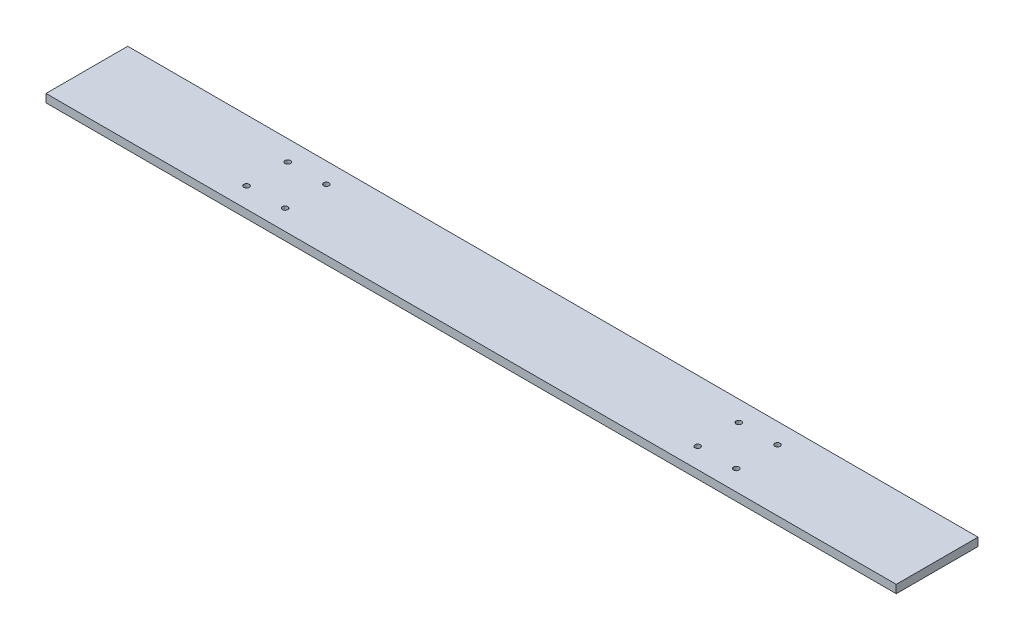
from build123d import *

# Parameters (mm, degrees)
SKETCH1_W           = 660.4
SKETCH1_H           = 63.5
BOSS_EXTRUDE1_DEPTH = 6.35
SKETCH2_R           = 2.1
CUT_EXTRUDE1_DEPTH  = 659.538185439


with BuildPart() as part:
    # Sketch1 → Boss-Extrude1 (new body)
    with BuildSketch(Plane(origin=(0, 0, 0), x_dir=(1, 0, 0), z_dir=(0, 1, 0))):
        with Locations((325.334455323, 30.754376368)):
            Rectangle(SKETCH1_W, SKETCH1_H)
    extrude(amount=BOSS_EXTRUDE1_DEPTH)

    # Sketch2 → Cut-Extrude1 (cut, through all)
    with BuildSketch(Plane(origin=(0, 6.35, 0), x_dir=(1, 0, 0), z_dir=(0, 1, 0))):
        with Locations(Location((515.534455323, 46.754376368, 0), (0, 0, 270))):
            Circle(SKETCH2_R)
        with Locations(Location((515.534455323, 14.754376368, 0), (0, 0, 270))):
            Circle(SKETCH2_R)
        with Locations(Location((485.534455323, 46.754376368, 0), (0, 0, 270))):
            Circle(SKETCH2_R)
        with Locations(Location((485.534455323, 14.754376368, 0), (0, 0, 270))):
            Circle(SKETCH2_R)
        with Locations(Location((165.134455323, 46.754376368, 0), (0, 0, 270))):
            Circle(SKETCH2_R)
        with Locations(Location((165.134455323, 14.754376368, 0), (0, 0, 270))):
            Circle(SKETCH2_R)
        with Locations(Location((135.134455323, 46.754376368, 0), (0, 0, 270))):
            Circle(SKETCH2_R)
        with Locations(Location((135.134455323, 14.754376368, 0), (0, 0, 270))):
            Circle(SKETCH2_R)
    extrude(amount=-CUT_EXTRUDE1_DEPTH, mode=Mode.SUBTRACT)


solid = part.part
